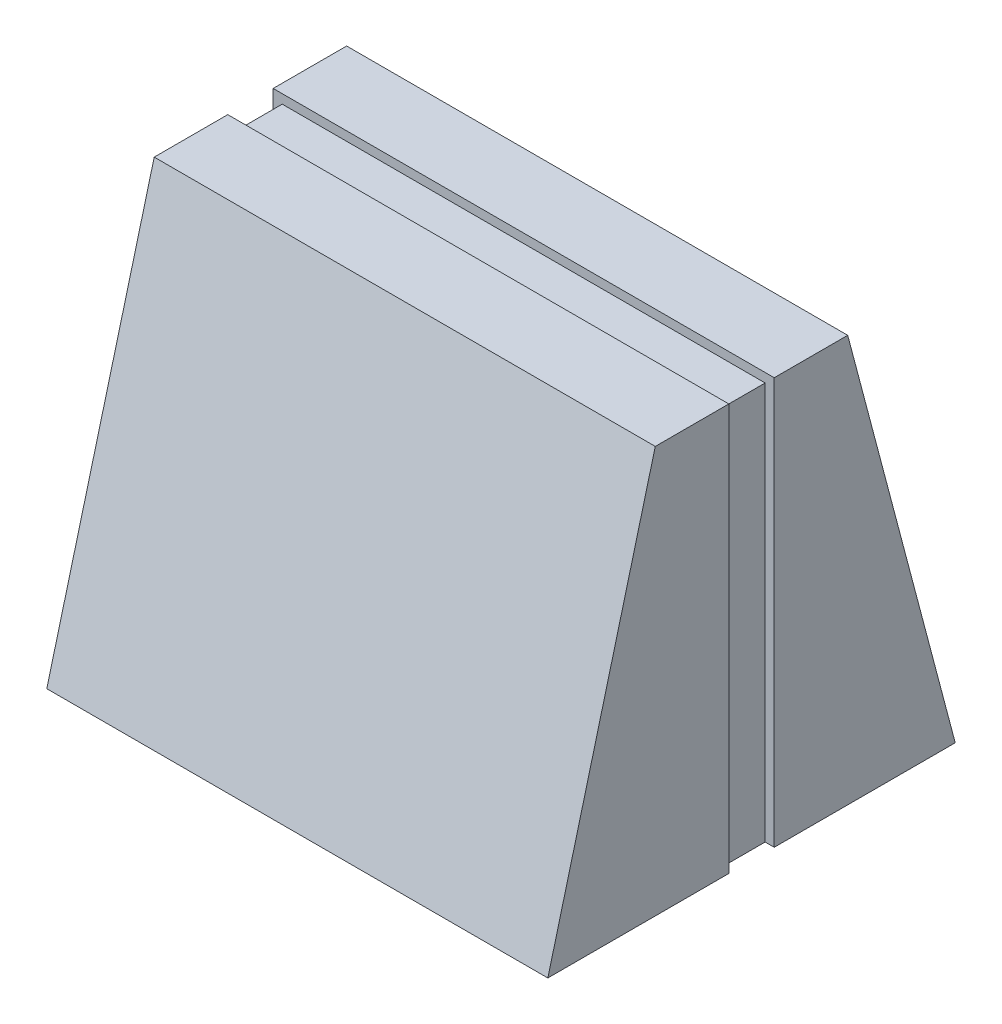
from build123d import *

# Parameters (mm, degrees)
SKETCH4_W          = 13.8
SKETCH4_H          = 1.25
CUT_EXTRUDE1_DEPTH = 0.25
SKETCH5_W          = 1.25
SKETCH5_H          = 10.95
CUT_EXTRUDE2_DEPTH = 0.25
SKETCH6_W          = 1.25
SKETCH6_H          = 10.95
CUT_EXTRUDE3_DEPTH = 0.25


with BuildPart() as part:
    # Sketch1 → Loft1 section 0
    with BuildSketch(Plane(origin=(0, 0, 0), x_dir=(1, 0, 0), z_dir=(0, 1, 0))):
        with BuildLine():
            Line((-6.9, -5.61), (6.9, -5.61))
            Line((6.9, -5.61), (6.9, 5.61))
            Line((6.9, 5.61), (-6.9, 5.61))
            Line((-6.9, 5.61), (-6.9, -5.61))
        make_face()
    # Sketch2 → Loft1 section 1
    with BuildSketch(Plane(origin=(0, 11.2, 0), x_dir=(1, 0, 0), z_dir=(0, 1, 0))):
        with BuildLine():
            Line((-6.9, -2.651033308), (6.9, -2.651033308))
            Line((6.9, -2.651033308), (6.9, 2.648966692))
            Line((6.9, 2.648966692), (-6.9, 2.648966692))
            Line((-6.9, 2.648966692), (-6.9, -2.651033308))
        make_face()
    loft()

    # Sketch4 → Cut-Extrude1 (cut)
    with BuildSketch(Plane(origin=(0, 11.2, 0), x_dir=(1, 0, 0), z_dir=(0, 1, 0))):
        Rectangle(SKETCH4_W, SKETCH4_H)
    extrude(amount=-CUT_EXTRUDE1_DEPTH, mode=Mode.SUBTRACT)

    # Sketch5 → Cut-Extrude2 (cut)
    with BuildSketch(Plane(origin=(6.9, 0, 0), x_dir=(0, 0, -1), z_dir=(1, 0, 0))):
        with Locations((0, 5.475)):
            Rectangle(SKETCH5_W, SKETCH5_H)
    extrude(amount=-CUT_EXTRUDE2_DEPTH, mode=Mode.SUBTRACT)

    # Sketch6 → Cut-Extrude3 (cut)
    with BuildSketch(Plane.ZY.offset(6.9)):
        with Locations((0, 5.475)):
            Rectangle(SKETCH6_W, SKETCH6_H)
    extrude(amount=-CUT_EXTRUDE3_DEPTH, mode=Mode.SUBTRACT)


solid = part.part
